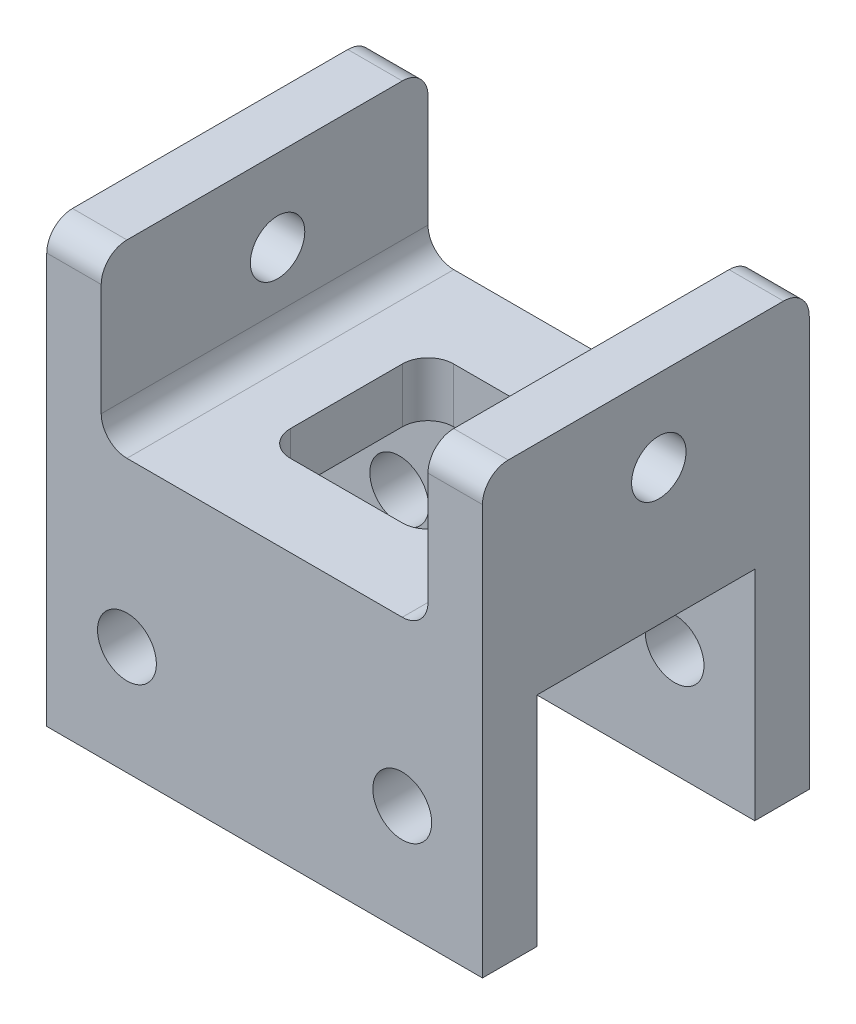
from build123d import *

# Parameters (mm, degrees)
SKETCH1_W               = 50.8
SKETCH1_H               = 38.1
BOSS_EXTRUDE1_DEPTH     = 31.75
SKETCH2_W               = 25.4
SKETCH2_H               = 25.4
CUT_EXTRUDE1_DEPTH      = 85.79053849
SKETCH3_W               = 6.35
SKETCH3_H               = 38.1
BOSS_EXTRUDE2_DEPTH     = 19.05
SKETCH4_W               = 6.35
SKETCH4_H               = 38.1
BOSS_EXTRUDE3_DEPTH     = 19.05
CUT_EXTRUDE2_DEPTH      = 91.317082645
CUT_EXTRUDE2_DEPTH_BACK = 91.317082645
SKETCH5_R               = 3.175
FILLET1_R               = 3
SKETCH6_R               = 3.429
CUT_EXTRUDE3_DEPTH      = 127.788108172
SKETCH7_R               = 3.429
CUT_EXTRUDE4_DEPTH      = 127.788108172
SKETCH8_W               = 19.05
SKETCH8_H               = 19.05
CUT_EXTRUDE5_DEPTH      = 130.041736625
FILLET2_R               = 3
FILLET3_R               = 3


with BuildPart() as part:
    # Sketch1 → Boss-Extrude1 (new body)
    with BuildSketch(Plane(origin=(0, 0, 0), x_dir=(1, 0, 0), z_dir=(0, 1, 0))):
        with Locations((-84.340486484, 40.956107335)):
            Rectangle(SKETCH1_W, SKETCH1_H)
    extrude(amount=BOSS_EXTRUDE1_DEPTH)

    # Sketch2 → Cut-Extrude1 (cut, through all)
    with BuildSketch(Plane(origin=(-58.940486484, 0, 0), x_dir=(0, 0, -1), z_dir=(1, 0, 0))):
        with Locations((40.956107335, 12.7)):
            Rectangle(SKETCH2_W, SKETCH2_H)
    extrude(amount=-CUT_EXTRUDE1_DEPTH, mode=Mode.SUBTRACT)

    # Sketch3 → Boss-Extrude2 (add)
    with BuildSketch(Plane(origin=(0, 31.75, 0), x_dir=(1, 0, 0), z_dir=(0, 1, 0))):
        with Locations((-106.565486484, 40.956107335)):
            Rectangle(SKETCH3_W, SKETCH3_H)
    extrude(amount=BOSS_EXTRUDE2_DEPTH)

    # Sketch4 → Boss-Extrude3 (add)
    with BuildSketch(Plane(origin=(0, 31.75, 0), x_dir=(1, 0, 0), z_dir=(0, 1, 0))):
        with Locations((-62.115486484, 40.956107335)):
            Rectangle(SKETCH4_W, SKETCH4_H)
    extrude(amount=BOSS_EXTRUDE3_DEPTH)

    # Sketch5 → Cut-Extrude2 (cut, two sides: drawn at the far end of the back side and taken through both)
    with BuildSketch(Plane(origin=(-103.390486484, 0, 0), x_dir=(0, 0, -1), z_dir=(1, 0, 0)).offset(-CUT_EXTRUDE2_DEPTH_BACK)):
        with Locations((42.465557169, 41.275)):
            Circle(SKETCH5_R)
    extrude(amount=CUT_EXTRUDE2_DEPTH + CUT_EXTRUDE2_DEPTH_BACK, mode=Mode.SUBTRACT)

    # Fillet1
    fillet1_edges = [part.edges().sort_by_distance(p)[0] for p in [
        (-106.565486484, 50.8, -60.006107335),
        (-106.565486484, 50.8, -21.906107335),
        (-62.115486484, 50.8, -21.906107335),
        (-62.115486484, 50.8, -60.006107335),
        (-65.290486484, 31.75, -40.956107335),
        (-103.390486484, 31.75, -40.956107335),
    ]]
    fillet(fillet1_edges, radius=FILLET1_R)

    # Sketch6 → Cut-Extrude3 (cut, through all)
    with BuildSketch(Plane(origin=(0, 0, -60.006107335), x_dir=(-1, 0, 0), z_dir=(0, 0, -1))):
        with Locations((68.290486484, 12.7)):
            Circle(SKETCH6_R)
    extrude(amount=-CUT_EXTRUDE3_DEPTH, mode=Mode.SUBTRACT)

    # Sketch7 → Cut-Extrude4 (cut, through all)
    with BuildSketch(Plane(origin=(0, 0, -60.006107335), x_dir=(-1, 0, 0), z_dir=(0, 0, -1))):
        with Locations((100.390486484, 12.7)):
            Circle(SKETCH7_R)
    extrude(amount=-CUT_EXTRUDE4_DEPTH, mode=Mode.SUBTRACT)

    # Sketch8 → Cut-Extrude5 (cut, through all)
    with BuildSketch(Plane(origin=(0, 31.75, 0), x_dir=(1, 0, 0), z_dir=(0, 1, 0))):
        with Locations((-84.340486484, 40.956107335)):
            Rectangle(SKETCH8_W, SKETCH8_H)
    extrude(amount=-CUT_EXTRUDE5_DEPTH, mode=Mode.SUBTRACT)

    # Fillet2
    fillet2_edges = [part.edges().sort_by_distance(p)[0] for p in [
        (-93.865486484, 28.575, -31.431107335),
        (-93.865486484, 28.575, -50.481107335),
    ]]
    fillet(fillet2_edges, radius=FILLET2_R)

    # Fillet3
    fillet3_edges = [part.edges().sort_by_distance(p)[0] for p in [
        (-74.815486484, 28.575, -50.481107335),
        (-74.815486484, 28.575, -31.431107335),
    ]]
    fillet(fillet3_edges, radius=FILLET3_R)


solid = part.part
